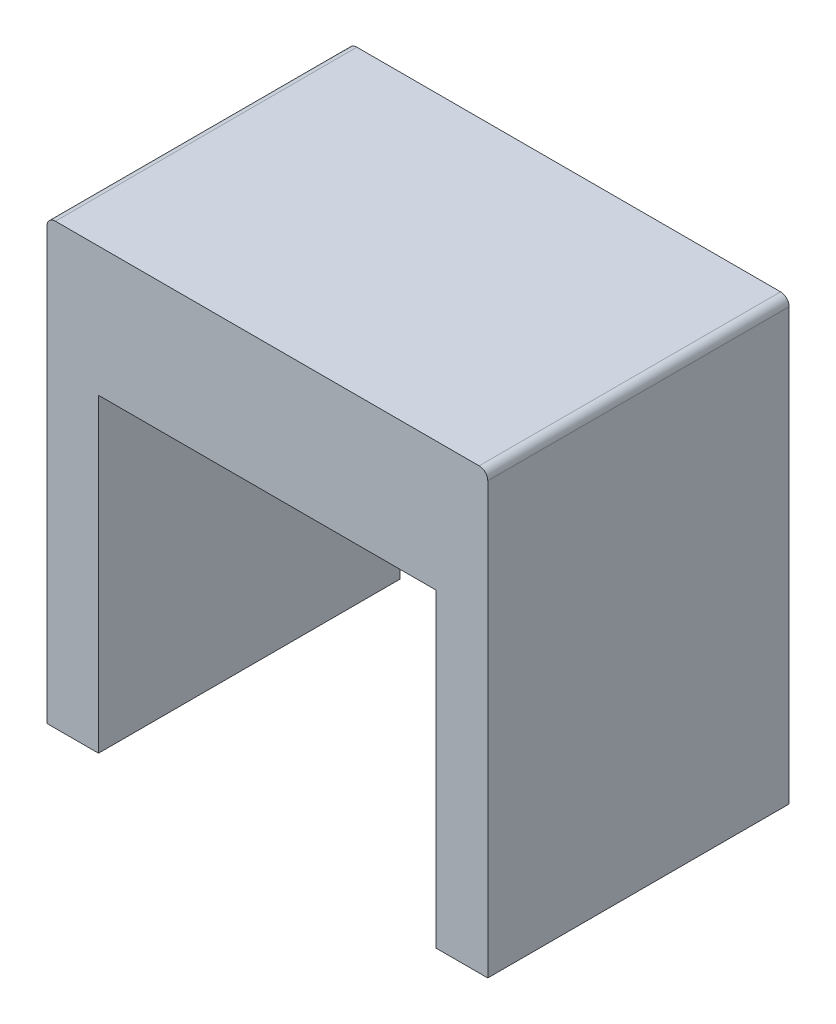
from build123d import *

# Parameters (mm, degrees)
BOSS_EXTRUDE1_DEPTH = 35
FILLET1_R           = 1


with BuildPart() as part:
    # Sketch1 → Boss-Extrude1 (new body)
    with BuildSketch(Plane.XY):
        Polygon((-25.340782123, -40.881284916), (-25.340782123, -4.881284916), (13.859217877, -4.881284916), (13.859217877, -40.881284916), (19.859217877, -40.881284916), (19.859217877, 10.118715084), (-31.340782123, 10.118715084), (-31.340782123, -40.881284916), align=None)
    extrude(amount=BOSS_EXTRUDE1_DEPTH)

    # Fillet1
    fillet1_edges = [part.edges().sort_by_distance(p)[0] for p in [
        (-31.340782123, 10.118715084, 17.5),
        (19.859217877, 10.118715084, 17.5),
    ]]
    fillet(fillet1_edges, radius=FILLET1_R)


solid = part.part
